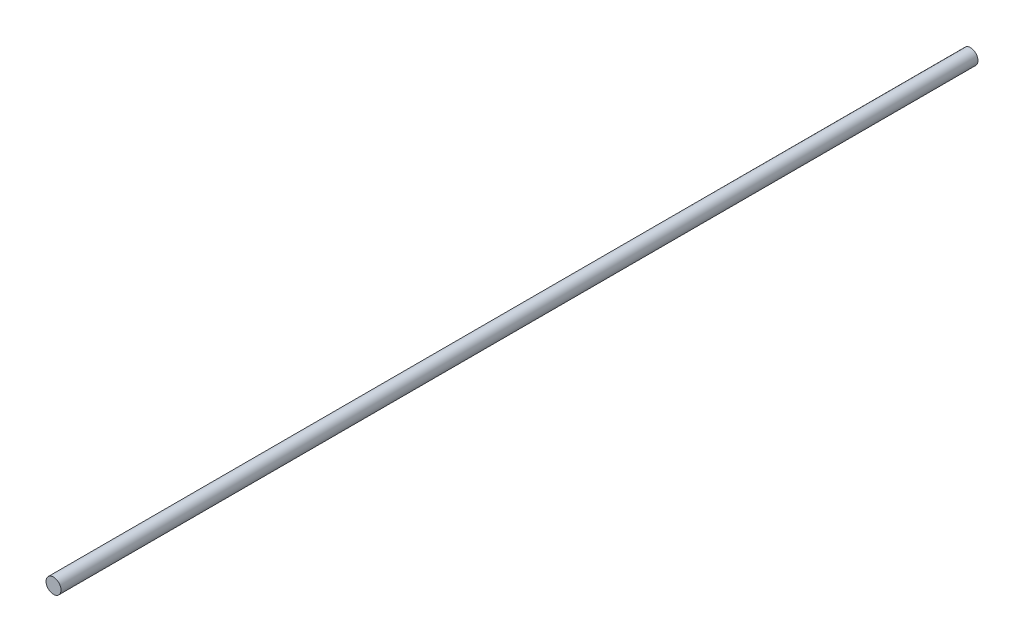
from build123d import *

# Parameters (mm, degrees)
SKETCH1_R           = 4
BOSS_EXTRUDE1_DEPTH = 489


with BuildPart() as part:
    # Sketch1 → Boss-Extrude1 (new body)
    with BuildSketch(Plane.XY):
        Circle(SKETCH1_R)
    extrude(amount=BOSS_EXTRUDE1_DEPTH)


solid = part.part
